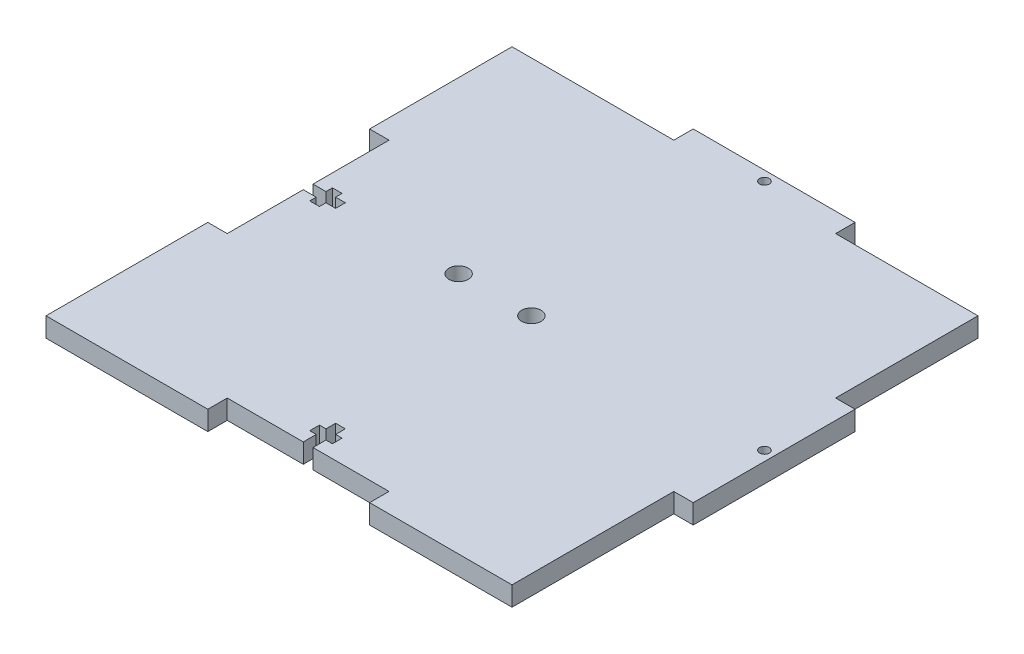
from build123d import *

# Parameters (mm, degrees)
SKETCH1_R           = 3
SKETCH1_R_2         = 1.5
BOSS_EXTRUDE1_DEPTH = 6


with BuildPart() as part:
    # Sketch1 → Boss-Extrude1 (new body)
    with BuildSketch(Plane(origin=(0, 0, 0), x_dir=(1, 0, 0), z_dir=(0, 1, 0))):
        Polygon((-72, 72), (-72, 28), (-66, 28), (-66, 4.5), (-62, 4.5), (-62, 6.5), (-59, 6.5), (-59, 4.5), (-56, 4.5), (-56, 1.5), (-59, 1.5), (-59, -0.5), (-62, -0.5), (-62, 1.5), (-66, 1.5), (-66, -22), (-72, -22), (-72, -72), (-22, -72), (-22, -66), (1.5, -66), (1.5, -62), (-0.5, -62), (-0.5, -59), (1.5, -59), (1.5, -56), (4.5, -56), (4.5, -59), (6.5, -59), (6.5, -62), (4.5, -62), (4.5, -66), (28, -66), (28, -72), (72, -72), (72, -22), (78, -22), (78, 28), (72, 28), (72, 72), (28, 72), (28, 78), (-22, 78), (-22, 72), align=None)
        with Locations(Location((-19.5, 3, 0), (0, 0, 270))):
            Circle(SKETCH1_R, mode=Mode.SUBTRACT)
        with Locations(Location((3, 3, 0), (0, 0, 270))):
            Circle(SKETCH1_R, mode=Mode.SUBTRACT)
        with Locations(Location((3, 75, 0), (0, 0, 270))):
            Circle(SKETCH1_R_2, mode=Mode.SUBTRACT)
        with Locations(Location((75, 3, 0), (0, 0, 270))):
            Circle(SKETCH1_R_2, mode=Mode.SUBTRACT)
    extrude(amount=BOSS_EXTRUDE1_DEPTH)


solid = part.part
